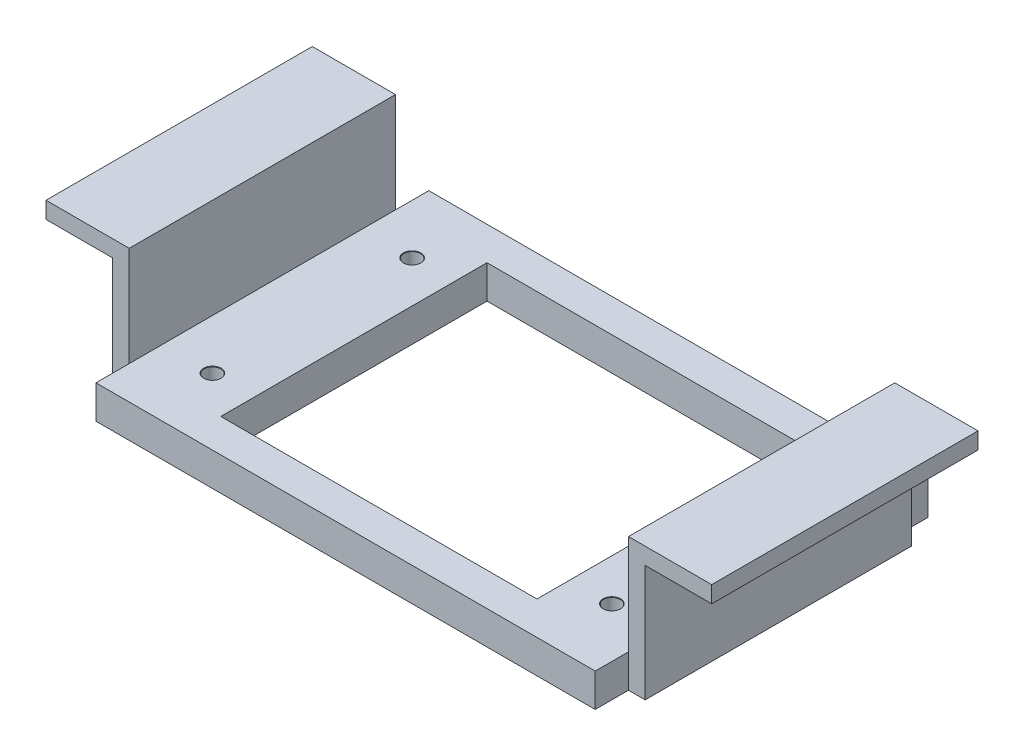
from build123d import *

# Parameters (mm, degrees)
SKETCH_1_W                      = 32
SKETCH_1_H                      = 16
EXTRUDE_1_DEPTH                 = 2
SKETCH_2_W                      = 1
SKETCH_2_H                      = 16
EXTRUDE_2_DEPTH                 = 6
SKETCH_3_W                      = 1
SKETCH_3_H                      = 16
EXTRUDE_3_DEPTH                 = 6
SKETCH_4_W                      = 16
SKETCH_4_H                      = 1
EXTRUDE_4_DEPTH                 = 4
SKETCH_5_W                      = 16
SKETCH_5_H                      = 1
EXTRUDE_5_DEPTH                 = 4
HOLE_WIZARD_1_0_1_1_D           = 1
HOLE_WIZARD_1_0_1_1_CSINK_D     = 1.05
HOLE_WIZARD_1_0_1_1_CSINK_ANGLE = 90
SKETCH_14_W                     = 29.99841147
SKETCH_14_H                     = 2
EXTRUDE_6_DEPTH                 = 2
SKETCH_15_W                     = 29.99841147
SKETCH_15_H                     = 2
EXTRUDE_7_DEPTH                 = 2
SKETCH_16_W                     = 19
SKETCH_16_H                     = 16
CUT_EXTRUDE_1_DEPTH             = 2


with BuildPart() as part:
    # 草图1 → 凸台-拉伸1 (new body)
    with BuildSketch(Plane(origin=(0, 0, 0), x_dir=(1, 0, 0), z_dir=(0, 1, 0))):
        Rectangle(SKETCH_1_W, SKETCH_1_H)
    extrude(amount=EXTRUDE_1_DEPTH)

    # 草图2 → 凸台-拉伸2 (add)
    with BuildSketch(Plane(origin=(0, 2, 0), x_dir=(1, 0, 0), z_dir=(0, 1, 0))):
        with Locations((-15.5, 0)):
            Rectangle(SKETCH_2_W, SKETCH_2_H)
    extrude(amount=EXTRUDE_2_DEPTH)

    # 草图3 → 凸台-拉伸3 (add)
    with BuildSketch(Plane(origin=(0, 2, 0), x_dir=(1, 0, 0), z_dir=(0, 1, 0))):
        with Locations((15.5, 0)):
            Rectangle(SKETCH_3_W, SKETCH_3_H)
    extrude(amount=EXTRUDE_3_DEPTH)

    # 草图4 → 凸台-拉伸4 (add)
    with BuildSketch(Plane.ZY.offset(16)):
        with Locations((0, 7.5)):
            Rectangle(SKETCH_4_W, SKETCH_4_H)
    extrude(amount=EXTRUDE_4_DEPTH)

    # 草图5 → 凸台-拉伸5 (add)
    with BuildSketch(Plane(origin=(16, 0, 0), x_dir=(0, 0, -1), z_dir=(1, 0, 0))):
        with Locations((0, 7.5)):
            Rectangle(SKETCH_5_W, SKETCH_5_H)
    extrude(amount=EXTRUDE_5_DEPTH)

    # Ø1.0 (1) 直径孔1 (through all)
    with Locations(Plane(origin=(0, 2, 0), x_dir=(1, 0, 0), z_dir=(0, 1, 0))):
        with Locations((-12, 6), (-12, -6), (12, -6), (12, 6)):
            CounterSinkHole(HOLE_WIZARD_1_0_1_1_D / 2, HOLE_WIZARD_1_0_1_1_CSINK_D / 2, counter_sink_angle=HOLE_WIZARD_1_0_1_1_CSINK_ANGLE)

    # 草图14 → 凸台-拉伸6 (add)
    with BuildSketch(Plane(origin=(0, 0, -8), x_dir=(-1, 0, 0), z_dir=(0, 0, -1))):
        with Locations((-0.000794265, 1)):
            Rectangle(SKETCH_14_W, SKETCH_14_H)
    extrude(amount=EXTRUDE_6_DEPTH)

    # 草图15 → 凸台-拉伸7 (add)
    with BuildSketch(Plane.XY.offset(8)):
        with Locations((-0.000794265, 1)):
            Rectangle(SKETCH_15_W, SKETCH_15_H)
    extrude(amount=EXTRUDE_7_DEPTH)

    # 草图16 → 切除-拉伸1 (cut)
    with BuildSketch(Plane(origin=(0, 2, 0), x_dir=(1, 0, 0), z_dir=(0, 1, 0))):
        Rectangle(SKETCH_16_W, SKETCH_16_H)
    extrude(amount=-CUT_EXTRUDE_1_DEPTH, mode=Mode.SUBTRACT)


solid = part.part
